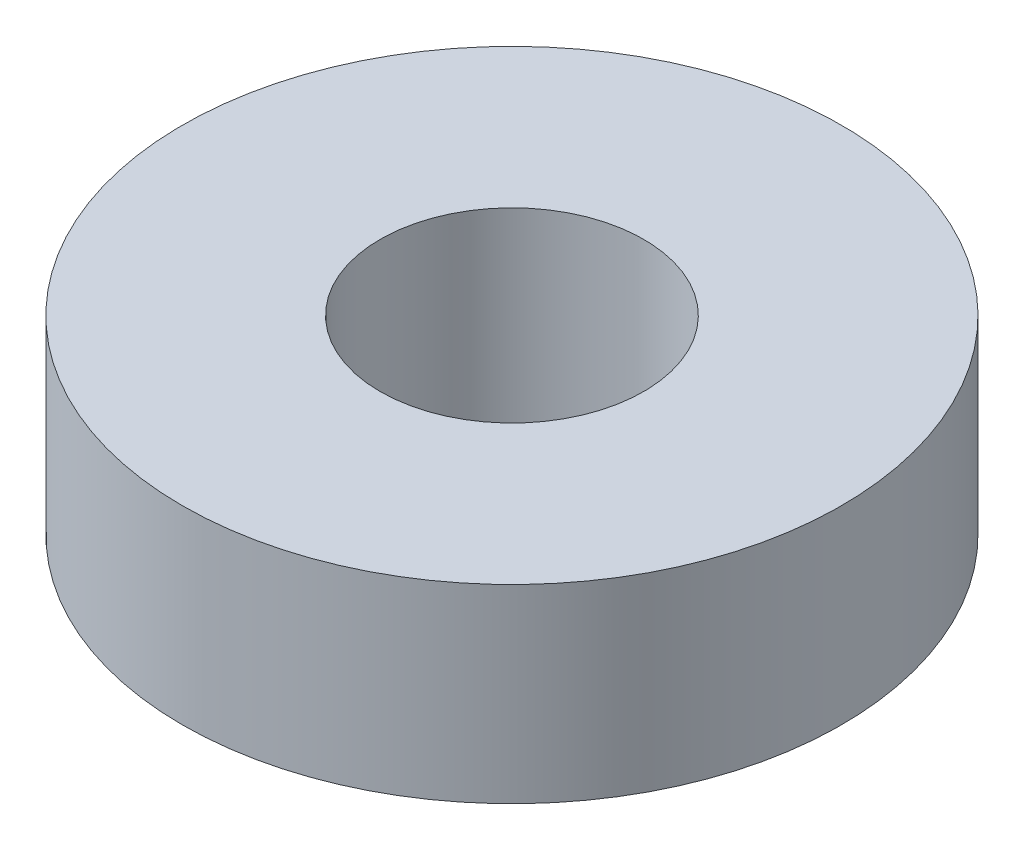
from build123d import *

# Parameters (mm, degrees)
SKETCH1_R           = 15.875
SKETCH1_R_2         = 6.35
BOSS_EXTRUDE1_DEPTH = 9.144


with BuildPart() as part:
    # Sketch1 → Boss-Extrude1 (new body)
    with BuildSketch(Plane(origin=(0, 0, 0), x_dir=(1, 0, 0), z_dir=(0, 1, 0))):
        with Locations(Location((0, 0, 0), (0, 0, 270))):
            Circle(SKETCH1_R)
        with Locations(Location((0, 0, 0), (0, 0, 270))):
            Circle(SKETCH1_R_2, mode=Mode.SUBTRACT)
    extrude(amount=BOSS_EXTRUDE1_DEPTH)


solid = part.part
